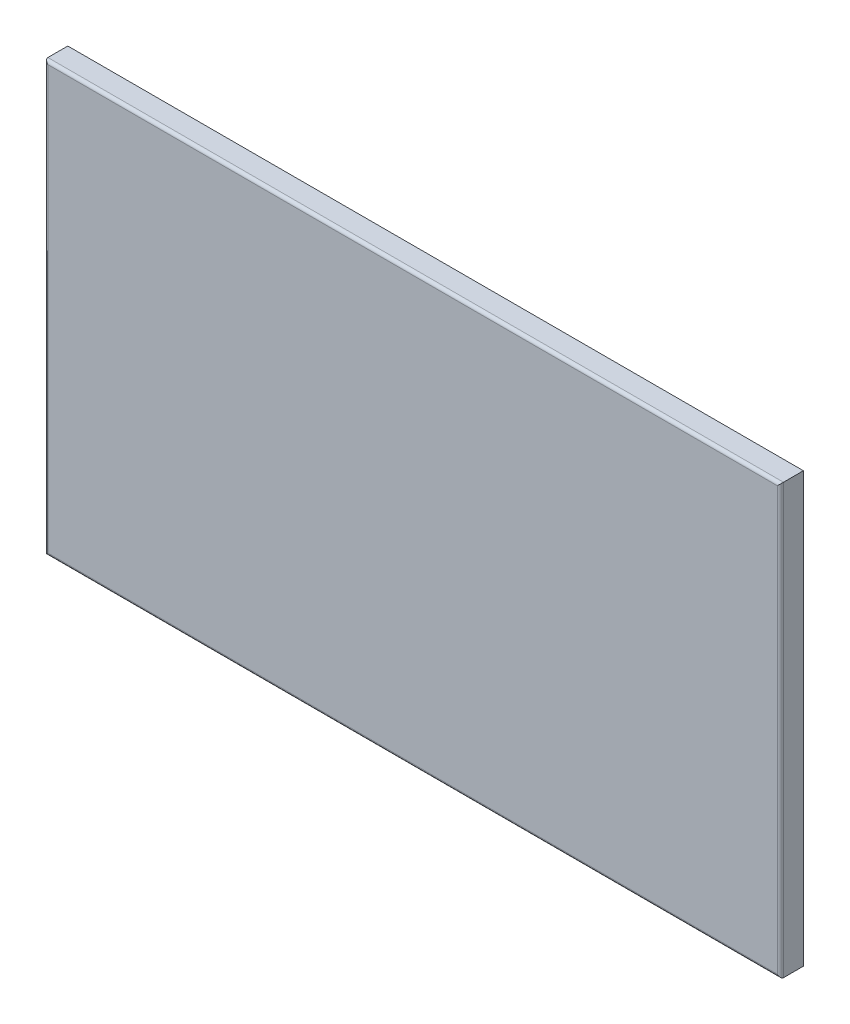
from build123d import *

# Parameters (mm, degrees)
SKETCH1_W           = 609.6
SKETCH1_H           = 355.6
BOSS_EXTRUDE1_DEPTH = 2.54
SKETCH2_W           = 609.6
SKETCH2_H           = 355.6
SKETCH2_W_2         = 604.52
SKETCH2_H_2         = 350.52
BOSS_EXTRUDE2_DEPTH = 19.05
FILLET1_R           = 2.54


with BuildPart() as part:
    # Sketch1 → Boss-Extrude1 (new body)
    with BuildSketch(Plane.XY):
        Rectangle(SKETCH1_W, SKETCH1_H)
    extrude(amount=BOSS_EXTRUDE1_DEPTH)

    # Sketch2 → Boss-Extrude2 (add)
    with BuildSketch(Plane.XY.offset(2.54)):
        Rectangle(SKETCH2_W, SKETCH2_H)
        Rectangle(SKETCH2_W_2, SKETCH2_H_2, mode=Mode.SUBTRACT)
    extrude(amount=-BOSS_EXTRUDE2_DEPTH)

    # Fillet1
    fillet1_edges = [part.edges().sort_by_distance(p)[0] for p in [
        (-304.8, 0, 2.54),
        (0, -177.8, 2.54),
        (304.8, 0, 2.54),
        (0, 177.8, 2.54),
    ]]
    fillet(fillet1_edges, radius=FILLET1_R)


solid = part.part
